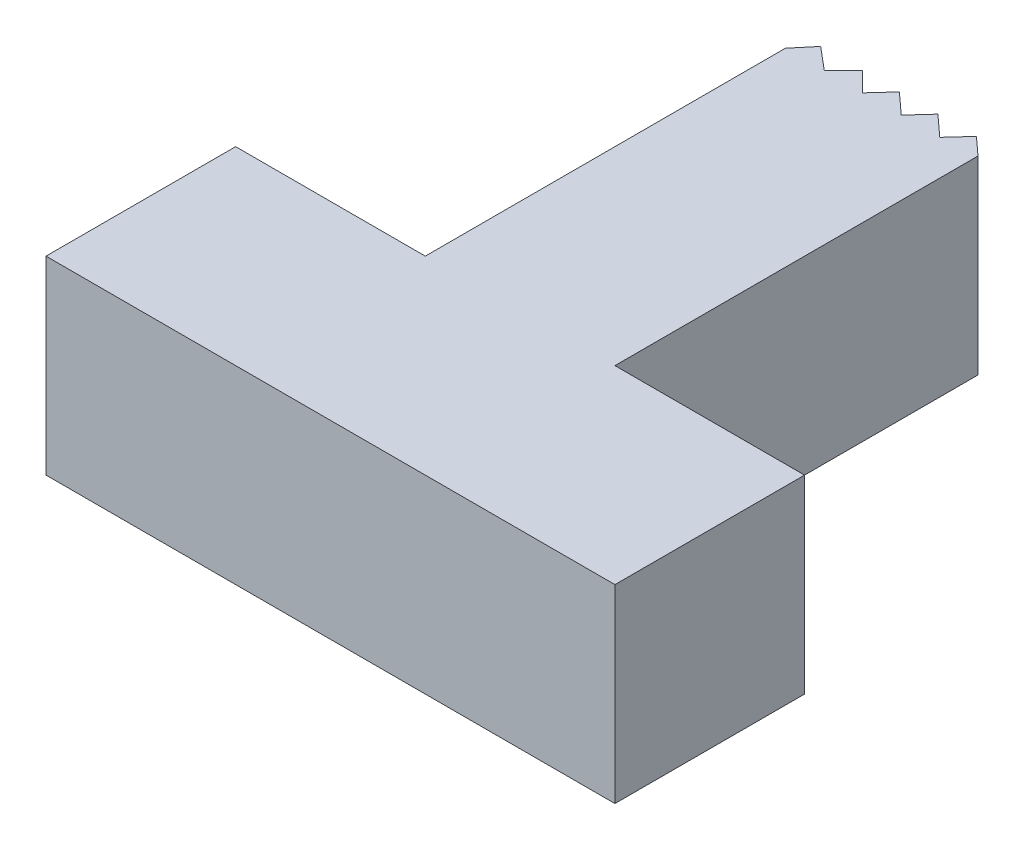
from build123d import *

# Parameters (mm, degrees)
SKETCH_1_W          = 6
SKETCH_1_H          = 2
EXTRUDE_1_DEPTH     = 2
SKETCH_2_W          = 2
SKETCH_2_H          = 2
EXTRUDE_2_DEPTH     = 4
CUT_EXTRUDE_1_DEPTH = 4


with BuildPart() as part:
    # 草图1 → 凸台-拉伸1 (new body)
    with BuildSketch(Plane.XY):
        Rectangle(SKETCH_1_W, SKETCH_1_H)
    extrude(amount=EXTRUDE_1_DEPTH)

    # 草图2 → 凸台-拉伸2 (add)
    with BuildSketch(Plane(origin=(0, 0, 0), x_dir=(-1, 0, 0), z_dir=(0, 0, -1))):
        Rectangle(SKETCH_2_W, SKETCH_2_H)
    extrude(amount=EXTRUDE_2_DEPTH)

    # 草图3 → 切除-拉伸1 (cut)
    with BuildSketch(Plane(origin=(0, 1, 0), x_dir=(1, 0, 0), z_dir=(0, 1, 0))):
        Polygon((-1, 3.79771899), (-0.830611616, 4), (-0.589050738, 3.79771899), (-0.387722732, 4), (-0.184484207, 3.79771899), (0, 4), (0.221794632, 3.79771899), (0.406278839, 4), (0.628073471, 3.79771899), (0.812557678, 4), (1, 3.829048964), (1.133730845, 3.829048964), (1.133730845, 4.163918303), (-1.101555404, 4.163918303), (-1.101555404, 3.79771899), align=None)
    extrude(amount=-CUT_EXTRUDE_1_DEPTH, mode=Mode.SUBTRACT)


solid = part.part
